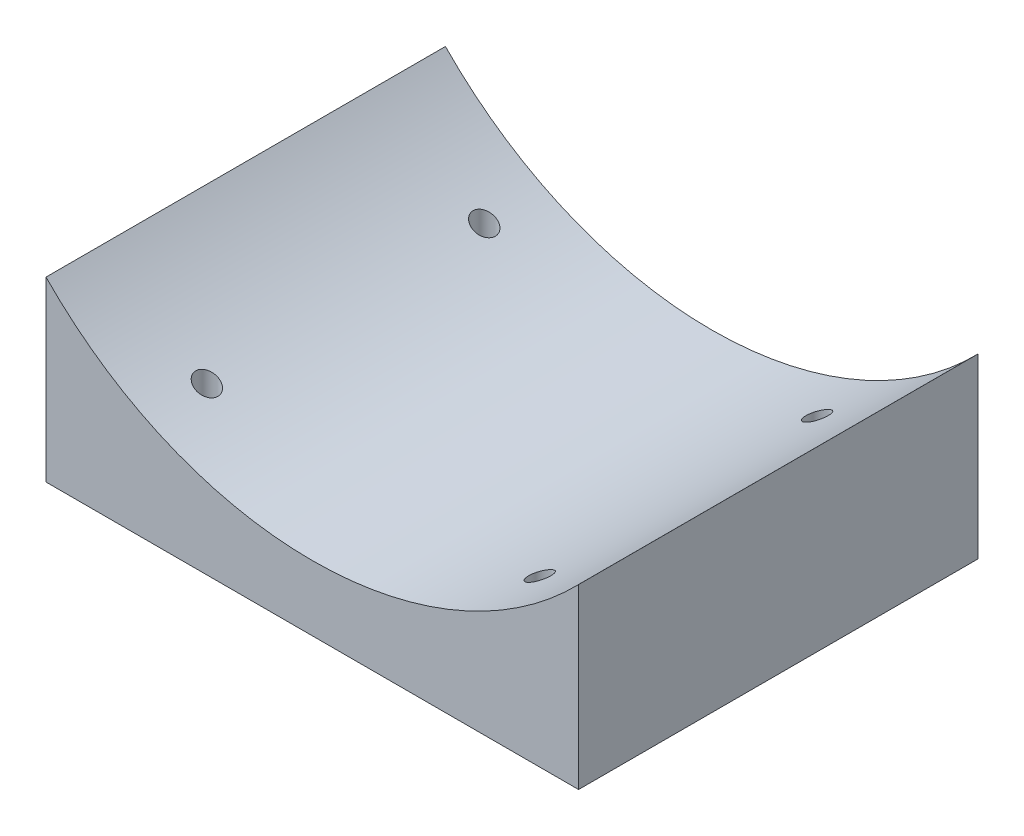
from build123d import *

# Parameters (mm, degrees)
IZIM1_R                     = 167.5
IZIM1_R_2                   = 148
Y_KSEKLIK_EKSTR_ZYON2_DEPTH = 185.3
IZIM9_R                     = 3.4
KES_EKSTR_ZYON1_DEPTH       = 15
IZIM10_W                    = 5
IZIM10_H                    = 16.407796145
Y_KSEKLIK_EKSTR_ZYON3_DEPTH = 180
IZIM13_W                    = 308.627991419
IZIM13_H                    = 53.891387346
KES_EKSTR_ZYON2_DEPTH       = 333
IZIM12_R                    = 5
KES_EKSTR_ZYON3_DEPTH       = 333


with BuildPart() as part:
    # Çizim1 → Yükseklik-Ekstrüzyon2 (new body)
    with BuildSketch(Plane.XY):
        Circle(IZIM1_R)
        Circle(IZIM1_R_2, mode=Mode.SUBTRACT)
    extrude(amount=Y_KSEKLIK_EKSTR_ZYON2_DEPTH)

    # Çizim9 → Kes-Ekstrüzyon1 (cut)
    with BuildSketch(Plane(origin=(0, 0, 0), x_dir=(-1, 0, 0), z_dir=(0, 0, -1))):
        with Locations((107.349895203, -112.5)):
            Circle(IZIM9_R)
        with Locations((-107.349895203, -112.5)):
            Circle(IZIM9_R)
        with Locations((-107.349895203, 112.5)):
            Circle(IZIM9_R)
        with Locations((107.349895203, 112.5)):
            Circle(IZIM9_R)
    kes_ekstr_zyon1 = extrude(amount=-KES_EKSTR_ZYON1_DEPTH, mode=Mode.SUBTRACT)

    # Çizim10 → Döndür1 (revolve)
    with BuildSketch(Plane(origin=(0, 0, 0), x_dir=(0, 0, -1), z_dir=(1, 0, 0)), mode=Mode.PRIVATE) as d_nd_r1_sk:
        with Locations((-32.5, 150.703898073)):
            Rectangle(IZIM10_W, IZIM10_H)
    revolve(d_nd_r1_sk.sketch.rotate(Axis((0, 0, 0), (0, 0, 1)), 90), axis=Axis((0, 0, 0), (0, 0, 1)))

    # Aynalama1: Kes-Ekstrüzyon1 across plane
    add(kes_ekstr_zyon1.mirror(Plane(origin=(0, 0, 92.65), x_dir=(1, 0, 0), z_dir=(0, 0, -1))), mode=Mode.SUBTRACT)


with BuildPart() as body_2:
    # Çizim11 → Yükseklik-Ekstrüzyon3 (new body)
    with BuildSketch(Plane.XY):
        with BuildLine():
            Line((120, -116.859958925), (120, -200))
            Line((120, -200), (-120, -200))
            Line((-120, -200), (-120, -116.859958925))
            ThreePointArc((-120, -116.859958925), (0, -167.5), (120, -116.859958925))
        make_face()
    extrude(amount=Y_KSEKLIK_EKSTR_ZYON3_DEPTH)

    # Çizim13 → Kes-Ekstrüzyon2 (cut)
    with BuildSketch(Plane.XY.offset(180)):
        with Locations((-6.112680509, -223.805652598)):
            Rectangle(IZIM13_W, IZIM13_H)
    extrude(amount=-KES_EKSTR_ZYON2_DEPTH, mode=Mode.SUBTRACT)

    # Çizim12 → Kes-Ekstrüzyon3 (cut)
    with BuildSketch(Plane.XZ.offset(200)):
        with Locations((-75, 152.5)):
            Circle(IZIM12_R)
        with Locations((75, 152.5)):
            Circle(IZIM12_R)
        with Locations((75, 27.5)):
            Circle(IZIM12_R)
        with Locations((-75, 27.5)):
            Circle(IZIM12_R)
    extrude(amount=-KES_EKSTR_ZYON3_DEPTH, mode=Mode.SUBTRACT)


solid = body_2.part
